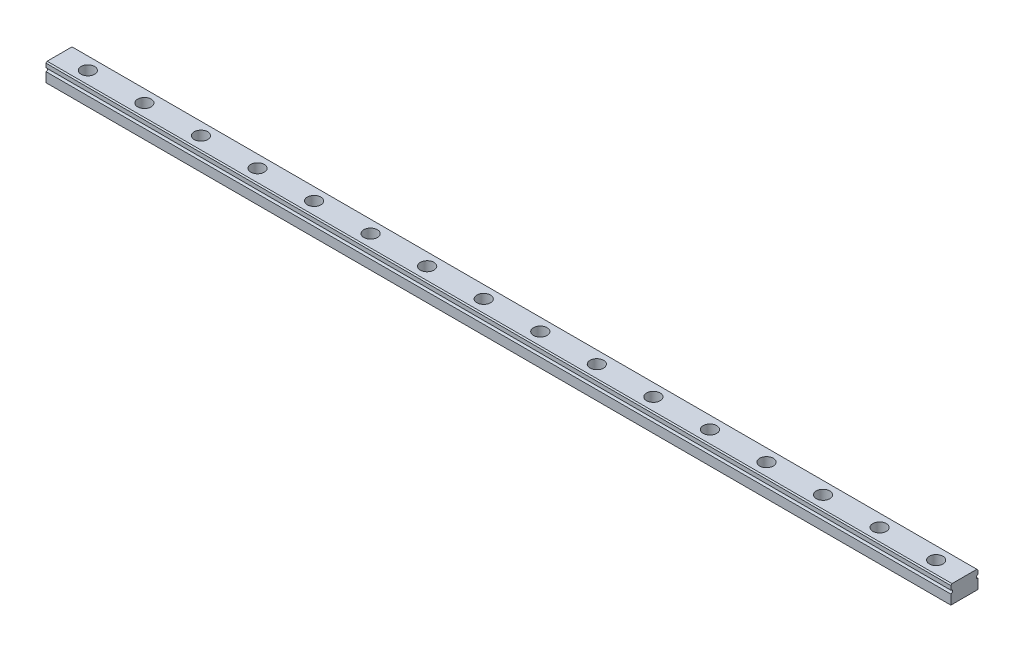
from build123d import *

# Parameters (mm, degrees)
AUFSATZ_LINEAR_AUSTRAGEN1_DEPTH                      = 400
FASE1_SIZE                                           = 0.5
STIRNSENKUNG_F_R_M3_D_NNKOPF_ZYLINDERSCH_D           = 4
STIRNSENKUNG_F_R_M3_D_NNKOPF_ZYLINDERSCH_CBORE_D     = 6
STIRNSENKUNG_F_R_M3_D_NNKOPF_ZYLINDERSCH_CBORE_DEPTH = 5


with BuildPart() as part:
    # Skizze1 → Aufsatz-Linear austragen1 (new body)
    with BuildSketch(Plane(origin=(0, 0, 0), x_dir=(0, 0, -1), z_dir=(1, 0, 0))):
        with BuildLine():
            Line((6, -4), (-6, -4))
            Line((-6, -4), (-6, 0.25))
            ThreePointArc((-6, 0.25), (-5.25, 1), (-6, 1.75))
            Line((-6, 1.75), (-6, 4))
            Line((-6, 4), (6, 4))
            Line((6, 4), (6, 1.75))
            ThreePointArc((6, 1.75), (5.25, 1), (6, 0.25))
            Line((6, 0.25), (6, -4))
        make_face()
    extrude(amount=AUFSATZ_LINEAR_AUSTRAGEN1_DEPTH)

    # Fase1
    fase1_edges = [part.edges().sort_by_distance(p)[0] for p in [
        (200, 4, 6),
        (200, 4, -6),
    ]]
    chamfer(fase1_edges, length=FASE1_SIZE)

    # Stirnsenkung für M3 Dünnkopf-Zylinderschraube mit Innensechskant1 (through all)
    with Locations(Plane(origin=(12.5, 4, 0), x_dir=(0, 0, 1), z_dir=(0, 1, 0))):
        with Locations((0, 0), (0, 375), (0, 350), (0, 325), (0, 300), (0, 275), (0, 250), (0, 225), (0, 200), (0, 175), (0, 150), (0, 125), (0, 100), (0, 75), (0, 50), (0, 25)):
            CounterBoreHole(STIRNSENKUNG_F_R_M3_D_NNKOPF_ZYLINDERSCH_D / 2, STIRNSENKUNG_F_R_M3_D_NNKOPF_ZYLINDERSCH_CBORE_D / 2, STIRNSENKUNG_F_R_M3_D_NNKOPF_ZYLINDERSCH_CBORE_DEPTH)


solid = part.part
